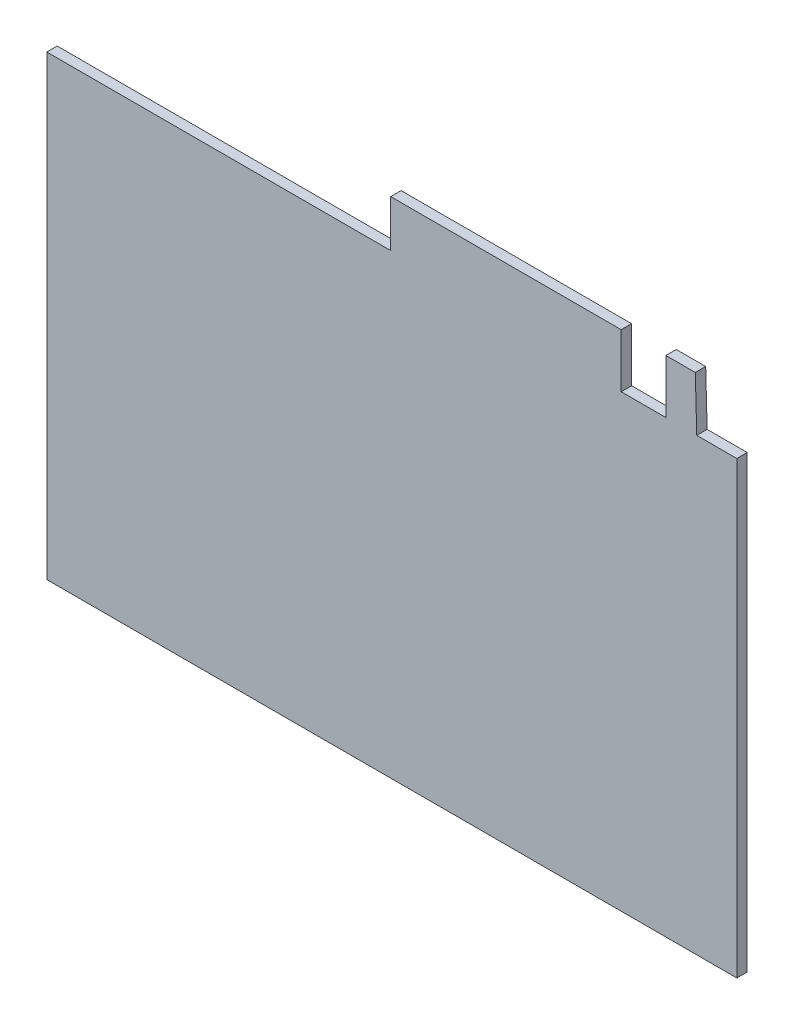
from build123d import *

# Parameters (mm, degrees)
BOSS_EXTRUDE1_DEPTH = 6


with BuildPart() as part:
    # Sketch1 → Boss-Extrude1 (new body)
    with BuildSketch(Plane.XY):
        Polygon((28.571428571, 236.060202245), (28.571428571, 237.05184048), (5.415486436, 237.05184048), (4.571428571, 268.104761905), (-12.428571429, 268.104761905), (-12.428571429, 237.05184048), (-38.216595912, 237.05184048), (-38.216595912, 268.104761905), (-171.428571429, 268.104761905), (-171.428571429, 241.104761905), (-370.123537574, 241.104761905), (-370.123537574, -22.895238095), (28.571428571, -22.895238095), align=None)
    extrude(amount=BOSS_EXTRUDE1_DEPTH)


solid = part.part
